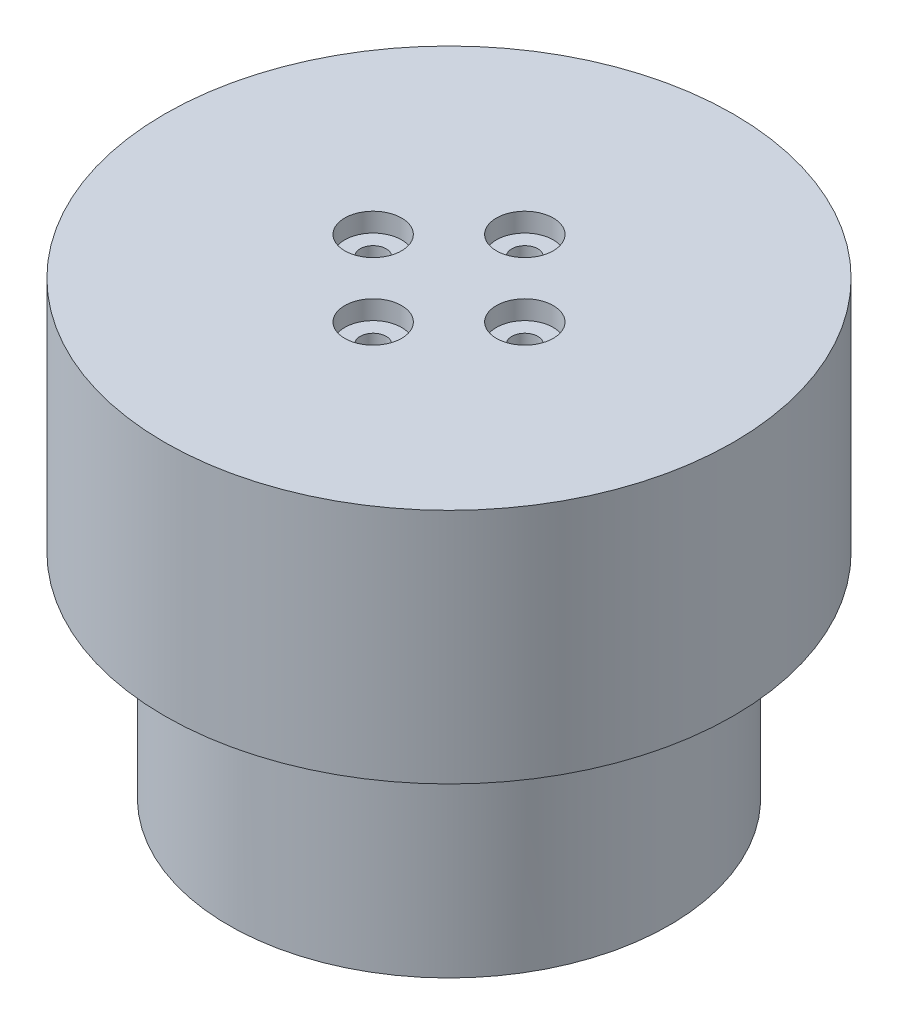
from build123d import *

# Parameters (mm, degrees)
ESQUISSE1_R              = 47.75
BOSS_EXTRU_1_DEPTH       = 50
ESQUISSE2_R              = 26
ENL_V_MAT_EXTRU_1_DEPTH  = 20
ESQUISSE3_R              = 11
ENL_V_MAT_EXTRU_5_DEPTH  = 7.5
ESQUISSE4_R              = 5
ENL_V_MAT_EXTRU_6_DEPTH  = 13.5
ESQUISSE11_R             = 2.75
ENL_V_MAT_EXTRU_11_DEPTH = 85.024549984
ESQUISSE12_R             = 47.75
ESQUISSE12_R_2           = 46.5
ENL_V_MAT_EXTRU_12_DEPTH = 85.024549984
ESQUISSE16_R             = 60
BOSS_EXTRU_3_DEPTH       = 50
ESQUISSE17_R             = 2.75
ENL_V_MAT_EXTRU_14_DEPTH = 128.377392029
ESQUISSE18_R             = 6
ENL_V_MAT_EXTRU_15_DEPTH = 4


with BuildPart() as part:
    # Esquisse1 → Boss.-Extru.1 (new body)
    with BuildSketch(Plane(origin=(0, 0, 0), x_dir=(1, 0, 0), z_dir=(0, 1, 0))):
        with Locations(Location((0, 0, 0), (0, 0, 270))):
            Circle(ESQUISSE1_R)
    extrude(amount=BOSS_EXTRU_1_DEPTH)

    # Esquisse2 → Enlèv. mat.-Extru.1 (cut)
    with BuildSketch(Plane(origin=(0, 0, 0), x_dir=(-1, 0, 0), z_dir=(0, -1, 0))):
        with Locations(Location((0, 0, 0), (0, 0, 90))):
            Circle(ESQUISSE2_R)
    extrude(amount=-ENL_V_MAT_EXTRU_1_DEPTH, mode=Mode.SUBTRACT)

    # Esquisse3 → Enlèv. mat.-Extru.5 (cut)
    with BuildSketch(Plane(origin=(0, 20, 0), x_dir=(-1, 0, 0), z_dir=(0, -1, 0))):
        with Locations(Location((0, 0, 0), (0, 0, 90))):
            Circle(ESQUISSE3_R)
    extrude(amount=-ENL_V_MAT_EXTRU_5_DEPTH, mode=Mode.SUBTRACT)

    # Esquisse4 → Enlèv. mat.-Extru.6 (cut)
    with BuildSketch(Plane(origin=(0, 27.5, 0), x_dir=(-1, 0, 0), z_dir=(0, -1, 0))):
        with Locations(Location((0, 0, 0), (0, 0, 90))):
            Circle(ESQUISSE4_R)
    extrude(amount=-ENL_V_MAT_EXTRU_6_DEPTH, mode=Mode.SUBTRACT)

    # Esquisse11 → Enlèv. mat.-Extru.11 (cut, through all)
    with BuildSketch(Plane(origin=(0, 50, 0), x_dir=(1, 0, 0), z_dir=(0, 1, 0))):
        with Locations(Location((-16, 0, 0), (0, 0, 270))):
            Circle(ESQUISSE11_R)
        with Locations(Location((0, 16, 0), (0, 0, 270))):
            Circle(ESQUISSE11_R)
        with Locations(Location((16, 0, 0), (0, 0, 270))):
            Circle(ESQUISSE11_R)
        with Locations(Location((0, -16, 0), (0, 0, 270))):
            Circle(ESQUISSE11_R)
    extrude(amount=-ENL_V_MAT_EXTRU_11_DEPTH, mode=Mode.SUBTRACT)

    # Esquisse12 → Enlèv. mat.-Extru.12 (cut, through all)
    with BuildSketch(Plane.XZ):
        Circle(ESQUISSE12_R)
        with Locations(Location((0, 0, 0), (0, 0, 270))):
            Circle(ESQUISSE12_R_2, mode=Mode.SUBTRACT)
    extrude(amount=-ENL_V_MAT_EXTRU_12_DEPTH, mode=Mode.SUBTRACT)

    # Enlèv. mat.-Surface1
    split(bisect_by=Plane(origin=(0, 45, 0), x_dir=(1, 0, 0), z_dir=(0, 1, 0)), keep=Keep.BOTTOM)

    # Esquisse16 → Boss.-Extru.3 (add)
    with BuildSketch(Plane(origin=(0, 45, 0), x_dir=(1, 0, 0), z_dir=(0, 1, 0))):
        with Locations(Location((0, 0, 0), (0, 0, 270))):
            Circle(ESQUISSE16_R)
    extrude(amount=BOSS_EXTRU_3_DEPTH)

    # Esquisse17 → Enlèv. mat.-Extru.14 (cut, through all)
    with BuildSketch(Plane(origin=(0, 95, 0), x_dir=(1, 0, 0), z_dir=(0, 1, 0))):
        with Locations(Location((0, -16, 0), (0, 0, 270))):
            Circle(ESQUISSE17_R)
        with Locations(Location((-16, 0, 0), (0, 0, 270))):
            Circle(ESQUISSE17_R)
        with Locations(Location((0, 16, 0), (0, 0, 270))):
            Circle(ESQUISSE17_R)
        with Locations(Location((16, 0, 0), (0, 0, 270))):
            Circle(ESQUISSE17_R)
    extrude(amount=-ENL_V_MAT_EXTRU_14_DEPTH, mode=Mode.SUBTRACT)

    # Esquisse18 → Enlèv. mat.-Extru.15 (cut)
    with BuildSketch(Plane(origin=(0, 95, 0), x_dir=(1, 0, 0), z_dir=(0, 1, 0))):
        with Locations(Location((0, 16, 0), (0, 0, 270))):
            Circle(ESQUISSE18_R)
        with Locations(Location((16, 0, 0), (0, 0, 270))):
            Circle(ESQUISSE18_R)
        with Locations(Location((0, -16, 0), (0, 0, 270))):
            Circle(ESQUISSE18_R)
        with Locations(Location((-16, 0, 0), (0, 0, 270))):
            Circle(ESQUISSE18_R)
    extrude(amount=-ENL_V_MAT_EXTRU_15_DEPTH, mode=Mode.SUBTRACT)


solid = part.part
